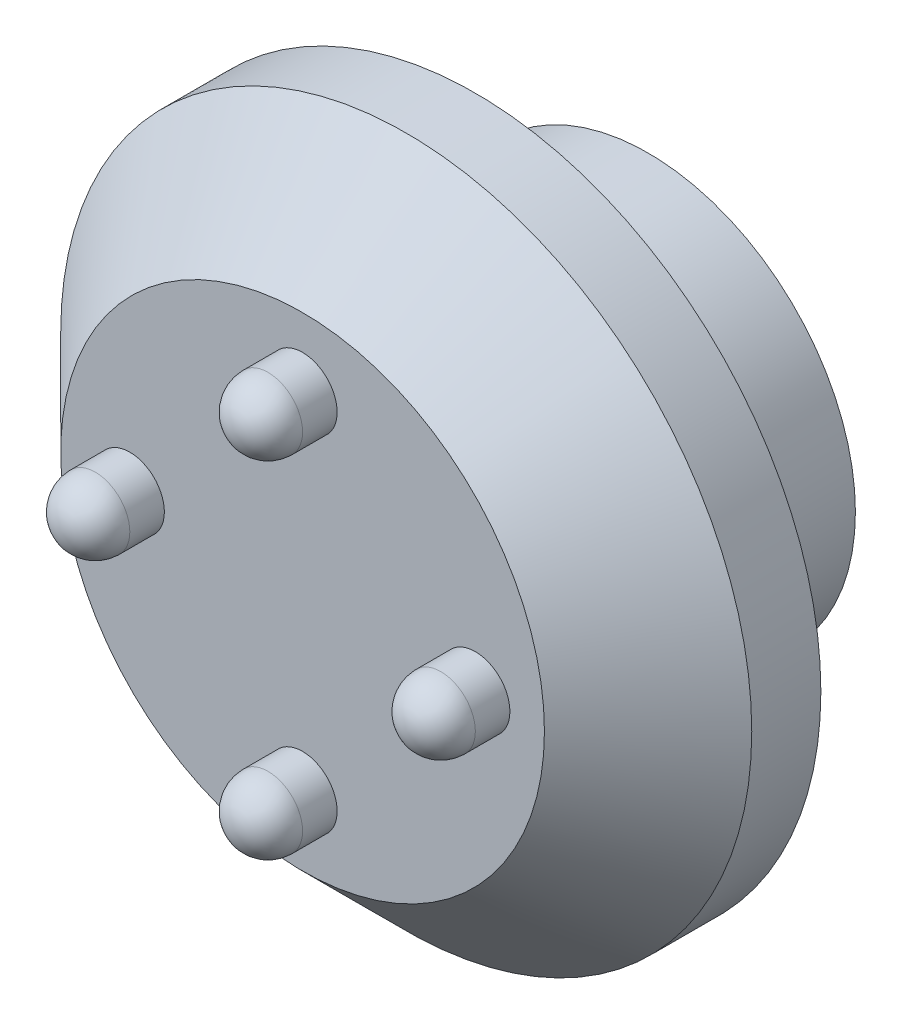
from build123d import *

# Parameters (mm, degrees)
BOSS_EXTRUDE1_DEPTH      = 5
BOSS_EXTRUDE1_DEPTH_BACK = 5
SKETCH1_R                = 6
SKETCH1_R_2              = 3.25
SKETCH2_R                = 10.000000149
BOSS_EXTRUDE2_DEPTH      = 5
CHAMFER1_SIZE            = 3
SKETCH3_R                = 1
BOSS_EXTRUDE3_DEPTH      = 2
BOSS_EXTRUDE3_2_DEPTH    = 2
BOSS_EXTRUDE3_3_DEPTH    = 2
BOSS_EXTRUDE3_4_DEPTH    = 2
FILLET1_R                = 1
FILLET2_R                = 1
FILLET3_R                = 1
FILLET4_R                = 1


with BuildPart() as part:
    # Sketch1 → Boss-Extrude1 (new, two sides: drawn at the far end of the back side and taken through both)
    with BuildSketch(Plane.XY.offset(-BOSS_EXTRUDE1_DEPTH_BACK)):
        Circle(SKETCH1_R)
        Circle(SKETCH1_R_2, mode=Mode.SUBTRACT)
    extrude(amount=BOSS_EXTRUDE1_DEPTH + BOSS_EXTRUDE1_DEPTH_BACK)

    # Sketch2 → Boss-Extrude2 (add)
    with BuildSketch(Plane.XY):
        Circle(SKETCH2_R)
    extrude(amount=BOSS_EXTRUDE2_DEPTH)

    # Chamfer1
    chamfer1_edges = [part.edges().sort_by_distance(p)[0] for p in [
        (-10.000000149, 0, 5),
    ]]
    chamfer(chamfer1_edges, length=CHAMFER1_SIZE)


with BuildPart() as body_2:
    # Sketch3 → Boss-Extrude3 (new body)
    with BuildSketch(Plane.XY.offset(5)):
        with Locations((0, 5)):
            Circle(SKETCH3_R)
    extrude(amount=BOSS_EXTRUDE3_DEPTH)

    # Fillet4
    fillet4_edges = [body_2.edges().sort_by_distance(p)[0] for p in [
        (-1, 5, 7),
    ]]
    fillet(fillet4_edges, radius=FILLET4_R)


with BuildPart() as body_3:
    # Sketch3 → Boss-Extrude3 2 (new body)
    with BuildSketch(Plane.XY.offset(5)):
        with Locations((5, 0)):
            Circle(SKETCH3_R)
    extrude(amount=BOSS_EXTRUDE3_2_DEPTH)

    # Fillet3
    fillet3_edges = [body_3.edges().sort_by_distance(p)[0] for p in [
        (4, 0, 7),
    ]]
    fillet(fillet3_edges, radius=FILLET3_R)


with BuildPart() as body_4:
    # Sketch3 → Boss-Extrude3 3 (new body)
    with BuildSketch(Plane.XY.offset(5)):
        with Locations((0, -5)):
            Circle(SKETCH3_R)
    extrude(amount=BOSS_EXTRUDE3_3_DEPTH)

    # Fillet2
    fillet2_edges = [body_4.edges().sort_by_distance(p)[0] for p in [
        (-1, -5, 7),
    ]]
    fillet(fillet2_edges, radius=FILLET2_R)


with BuildPart() as body_5:
    # Sketch3 → Boss-Extrude3 4 (new body)
    with BuildSketch(Plane.XY.offset(5)):
        with Locations((-5, 0)):
            Circle(SKETCH3_R)
    extrude(amount=BOSS_EXTRUDE3_4_DEPTH)

    # Fillet1
    fillet1_edges = [body_5.edges().sort_by_distance(p)[0] for p in [
        (-6, 0, 7),
    ]]
    fillet(fillet1_edges, radius=FILLET1_R)


solid = Compound([part.part, body_2.part, body_3.part, body_4.part, body_5.part])
